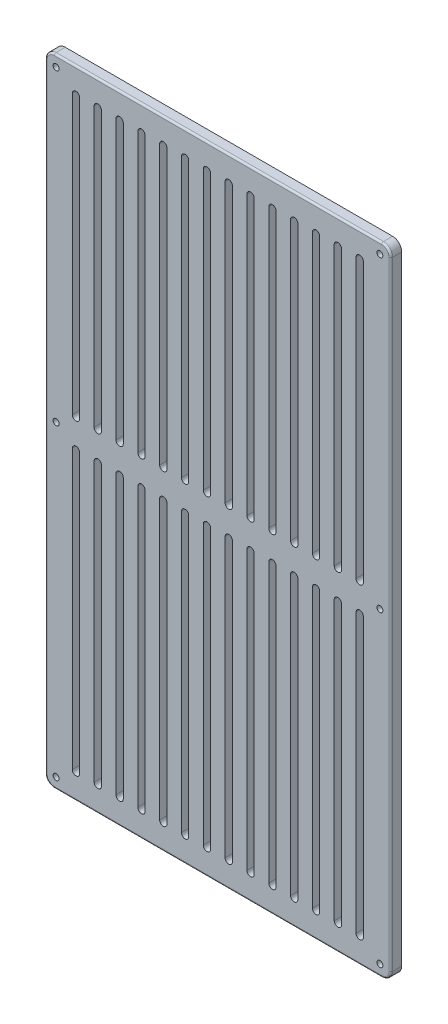
from build123d import *

# Parameters (mm, degrees)
SKETCH1_R           = 1.65
BOSS_EXTRUDE1_DEPTH = 6
CHAMFER1_SIZE       = 1.1
FILLET1_R           = 1


with BuildPart() as part:
    # Sketch1 → Boss-Extrude1 (new body)
    with BuildSketch(Plane.XY):
        with BuildLine():
            Line((1, 6), (1, 346))
            ThreePointArc((1, 346), (2.464466094, 349.535533906), (6, 351))
            Line((6, 351), (186, 351))
            ThreePointArc((186, 351), (189.535533906, 349.535533906), (191, 346))
            Line((191, 346), (191, 6))
            ThreePointArc((191, 6), (189.535533906, 2.464466094), (186, 1))
            Line((186, 1), (6, 1))
            ThreePointArc((6, 1), (2.464466094, 2.464466094), (1, 6))
        make_face()
        with Locations((7, 345)):
            Circle(SKETCH1_R, mode=Mode.SUBTRACT)
        with Locations((185, 345)):
            Circle(SKETCH1_R, mode=Mode.SUBTRACT)
        with Locations((7, 7)):
            Circle(SKETCH1_R, mode=Mode.SUBTRACT)
        with Locations((185, 7)):
            Circle(SKETCH1_R, mode=Mode.SUBTRACT)
        with Locations((7, 176)):
            Circle(SKETCH1_R, mode=Mode.SUBTRACT)
        with Locations((185, 176)):
            Circle(SKETCH1_R, mode=Mode.SUBTRACT)
        with BuildLine():
            Line((123.902123688, 337), (123.902123688, 184))
            ThreePointArc((123.902123688, 184), (125.902123688, 182), (127.902123688, 184))
            Line((127.902123688, 184), (127.902123688, 337))
            ThreePointArc((127.902123688, 337), (125.902123688, 339), (123.902123688, 337))
        make_face(mode=Mode.SUBTRACT)
        with BuildLine():
            ThreePointArc((55.902123688, 337), (53.902123688, 339), (51.902123688, 337))
            Line((51.902123688, 337), (51.902123688, 184))
            ThreePointArc((51.902123688, 184), (53.902123688, 182), (55.902123688, 184))
            Line((55.902123688, 184), (55.902123688, 337))
        make_face(mode=Mode.SUBTRACT)
        with BuildLine():
            Line((175.902123688, 337), (175.902123688, 184))
            ThreePointArc((175.902123688, 184), (173.902123688, 182), (171.902123688, 184))
            Line((171.902123688, 184), (171.902123688, 337))
            ThreePointArc((171.902123688, 337), (173.902123688, 339), (175.902123688, 337))
        make_face(mode=Mode.SUBTRACT)
        with BuildLine():
            Line((163.902123688, 337), (163.902123688, 184))
            ThreePointArc((163.902123688, 184), (161.902123688, 182), (159.902123688, 184))
            Line((159.902123688, 184), (159.902123688, 337))
            ThreePointArc((159.902123688, 337), (161.902123688, 339), (163.902123688, 337))
        make_face(mode=Mode.SUBTRACT)
        with BuildLine():
            Line((151.902123688, 337), (151.902123688, 184))
            ThreePointArc((151.902123688, 184), (149.902123688, 182), (147.902123688, 184))
            Line((147.902123688, 184), (147.902123688, 337))
            ThreePointArc((147.902123688, 337), (149.902123688, 339), (151.902123688, 337))
        make_face(mode=Mode.SUBTRACT)
        with BuildLine():
            Line((139.902123688, 337), (139.902123688, 184))
            ThreePointArc((139.902123688, 184), (137.902123688, 182), (135.902123688, 184))
            Line((135.902123688, 184), (135.902123688, 337))
            ThreePointArc((135.902123688, 337), (137.902123688, 339), (139.902123688, 337))
        make_face(mode=Mode.SUBTRACT)
        with BuildLine():
            Line((115.902123688, 337), (115.902123688, 184))
            ThreePointArc((115.902123688, 184), (113.902123688, 182), (111.902123688, 184))
            Line((111.902123688, 184), (111.902123688, 337))
            ThreePointArc((111.902123688, 337), (113.902123688, 339), (115.902123688, 337))
        make_face(mode=Mode.SUBTRACT)
        with BuildLine():
            Line((99.902123688, 337), (99.902123688, 184))
            ThreePointArc((99.902123688, 184), (101.902123688, 182), (103.902123688, 184))
            Line((103.902123688, 184), (103.902123688, 337))
            ThreePointArc((103.902123688, 337), (101.902123688, 339), (99.902123688, 337))
        make_face(mode=Mode.SUBTRACT)
        with BuildLine():
            Line((91.902123688, 337), (91.902123688, 184))
            ThreePointArc((91.902123688, 184), (89.902123688, 182), (87.902123688, 184))
            Line((87.902123688, 184), (87.902123688, 337))
            ThreePointArc((87.902123688, 337), (89.902123688, 339), (91.902123688, 337))
        make_face(mode=Mode.SUBTRACT)
        with BuildLine():
            Line((79.902123688, 337), (79.902123688, 184))
            ThreePointArc((79.902123688, 184), (77.902123688, 182), (75.902123688, 184))
            Line((75.902123688, 184), (75.902123688, 337))
            ThreePointArc((75.902123688, 337), (77.902123688, 339), (79.902123688, 337))
        make_face(mode=Mode.SUBTRACT)
        with BuildLine():
            Line((63.902123688, 337), (63.902123688, 184))
            ThreePointArc((63.902123688, 184), (65.902123688, 182), (67.902123688, 184))
            Line((67.902123688, 184), (67.902123688, 337))
            ThreePointArc((67.902123688, 337), (65.902123688, 339), (63.902123688, 337))
        make_face(mode=Mode.SUBTRACT)
        with BuildLine():
            Line((43.902123688, 337), (43.902123688, 184))
            ThreePointArc((43.902123688, 184), (41.902123688, 182), (39.902123688, 184))
            Line((39.902123688, 184), (39.902123688, 337))
            ThreePointArc((39.902123688, 337), (41.902123688, 339), (43.902123688, 337))
        make_face(mode=Mode.SUBTRACT)
        with BuildLine():
            Line((19.902123688, 337), (19.902123688, 184))
            ThreePointArc((19.902123688, 184), (17.902123688, 182), (15.902123688, 184))
            Line((15.902123688, 184), (15.902123688, 337))
            ThreePointArc((15.902123688, 337), (17.902123688, 339), (19.902123688, 337))
        make_face(mode=Mode.SUBTRACT)
        with BuildLine():
            Line((27.902123688, 337), (27.902123688, 184))
            ThreePointArc((27.902123688, 184), (29.902123688, 182), (31.902123688, 184))
            Line((31.902123688, 184), (31.902123688, 337))
            ThreePointArc((31.902123688, 337), (29.902123688, 339), (27.902123688, 337))
        make_face(mode=Mode.SUBTRACT)
        with BuildLine():
            Line((171.902123688, 15), (171.902123688, 168))
            ThreePointArc((171.902123688, 168), (173.902123688, 170), (175.902123688, 168))
            Line((175.902123688, 168), (175.902123688, 15))
            ThreePointArc((175.902123688, 15), (173.902123688, 13), (171.902123688, 15))
        make_face(mode=Mode.SUBTRACT)
        with BuildLine():
            Line((159.902123688, 15), (159.902123688, 168))
            ThreePointArc((159.902123688, 168), (161.902123688, 170), (163.902123688, 168))
            Line((163.902123688, 168), (163.902123688, 15))
            ThreePointArc((163.902123688, 15), (161.902123688, 13), (159.902123688, 15))
        make_face(mode=Mode.SUBTRACT)
        with BuildLine():
            Line((147.902123688, 15), (147.902123688, 168))
            ThreePointArc((147.902123688, 168), (149.902123688, 170), (151.902123688, 168))
            Line((151.902123688, 168), (151.902123688, 15))
            ThreePointArc((151.902123688, 15), (149.902123688, 13), (147.902123688, 15))
        make_face(mode=Mode.SUBTRACT)
        with BuildLine():
            Line((135.902123688, 15), (135.902123688, 168))
            ThreePointArc((135.902123688, 168), (137.902123688, 170), (139.902123688, 168))
            Line((139.902123688, 168), (139.902123688, 15))
            ThreePointArc((139.902123688, 15), (137.902123688, 13), (135.902123688, 15))
        make_face(mode=Mode.SUBTRACT)
        with BuildLine():
            Line((123.902123688, 15), (123.902123688, 168))
            ThreePointArc((123.902123688, 168), (125.902123688, 170), (127.902123688, 168))
            Line((127.902123688, 168), (127.902123688, 15))
            ThreePointArc((127.902123688, 15), (125.902123688, 13), (123.902123688, 15))
        make_face(mode=Mode.SUBTRACT)
        with BuildLine():
            Line((111.902123688, 15), (111.902123688, 168))
            ThreePointArc((111.902123688, 168), (113.902123688, 170), (115.902123688, 168))
            Line((115.902123688, 168), (115.902123688, 15))
            ThreePointArc((115.902123688, 15), (113.902123688, 13), (111.902123688, 15))
        make_face(mode=Mode.SUBTRACT)
        with BuildLine():
            Line((99.902123688, 15), (99.902123688, 168))
            ThreePointArc((99.902123688, 168), (101.902123688, 170), (103.902123688, 168))
            Line((103.902123688, 168), (103.902123688, 15))
            ThreePointArc((103.902123688, 15), (101.902123688, 13), (99.902123688, 15))
        make_face(mode=Mode.SUBTRACT)
        with BuildLine():
            Line((87.902123688, 15), (87.902123688, 168))
            ThreePointArc((87.902123688, 168), (89.902123688, 170), (91.902123688, 168))
            Line((91.902123688, 168), (91.902123688, 15))
            ThreePointArc((91.902123688, 15), (89.902123688, 13), (87.902123688, 15))
        make_face(mode=Mode.SUBTRACT)
        with BuildLine():
            Line((75.902123688, 15), (75.902123688, 168))
            ThreePointArc((75.902123688, 168), (77.902123688, 170), (79.902123688, 168))
            Line((79.902123688, 168), (79.902123688, 15))
            ThreePointArc((79.902123688, 15), (77.902123688, 13), (75.902123688, 15))
        make_face(mode=Mode.SUBTRACT)
        with BuildLine():
            Line((63.902123688, 15), (63.902123688, 168))
            ThreePointArc((63.902123688, 168), (65.902123688, 170), (67.902123688, 168))
            Line((67.902123688, 168), (67.902123688, 15))
            ThreePointArc((67.902123688, 15), (65.902123688, 13), (63.902123688, 15))
        make_face(mode=Mode.SUBTRACT)
        with BuildLine():
            Line((51.902123688, 15), (51.902123688, 168))
            ThreePointArc((51.902123688, 168), (53.902123688, 170), (55.902123688, 168))
            Line((55.902123688, 168), (55.902123688, 15))
            ThreePointArc((55.902123688, 15), (53.902123688, 13), (51.902123688, 15))
        make_face(mode=Mode.SUBTRACT)
        with BuildLine():
            Line((39.902123688, 15), (39.902123688, 168))
            ThreePointArc((39.902123688, 168), (41.902123688, 170), (43.902123688, 168))
            Line((43.902123688, 168), (43.902123688, 15))
            ThreePointArc((43.902123688, 15), (41.902123688, 13), (39.902123688, 15))
        make_face(mode=Mode.SUBTRACT)
        with BuildLine():
            Line((27.902123688, 15), (27.902123688, 168))
            ThreePointArc((27.902123688, 168), (29.902123688, 170), (31.902123688, 168))
            Line((31.902123688, 168), (31.902123688, 15))
            ThreePointArc((31.902123688, 15), (29.902123688, 13), (27.902123688, 15))
        make_face(mode=Mode.SUBTRACT)
        with BuildLine():
            Line((19.902123688, 15), (19.902123688, 168))
            ThreePointArc((19.902123688, 168), (17.902123688, 170), (15.902123688, 168))
            Line((15.902123688, 168), (15.902123688, 15))
            ThreePointArc((15.902123688, 15), (17.902123688, 13), (19.902123688, 15))
        make_face(mode=Mode.SUBTRACT)
    extrude(amount=BOSS_EXTRUDE1_DEPTH)

    # Chamfer1
    chamfer1_edges = [part.edges().sort_by_distance(p)[0] for p in [
        (5.35, 345, 0),
        (183.35, 345, 0),
        (5.35, 7, 0),
        (183.35, 7, 0),
        (5.35, 176, 0),
        (183.35, 176, 0),
    ]]
    chamfer(chamfer1_edges, length=CHAMFER1_SIZE)

    # Fillet1
    fillet1_edges = [part.edges().sort_by_distance(p)[0] for p in [
        (189.535533906, 349.535533906, 6),
        (96, 351, 6),
        (2.464466094, 349.535533906, 6),
        (1, 176, 6),
        (2.464466094, 2.464466094, 6),
        (96, 1, 6),
        (189.535533906, 2.464466094, 6),
        (191, 176, 6),
    ]]
    fillet(fillet1_edges, radius=FILLET1_R)


solid = part.part
